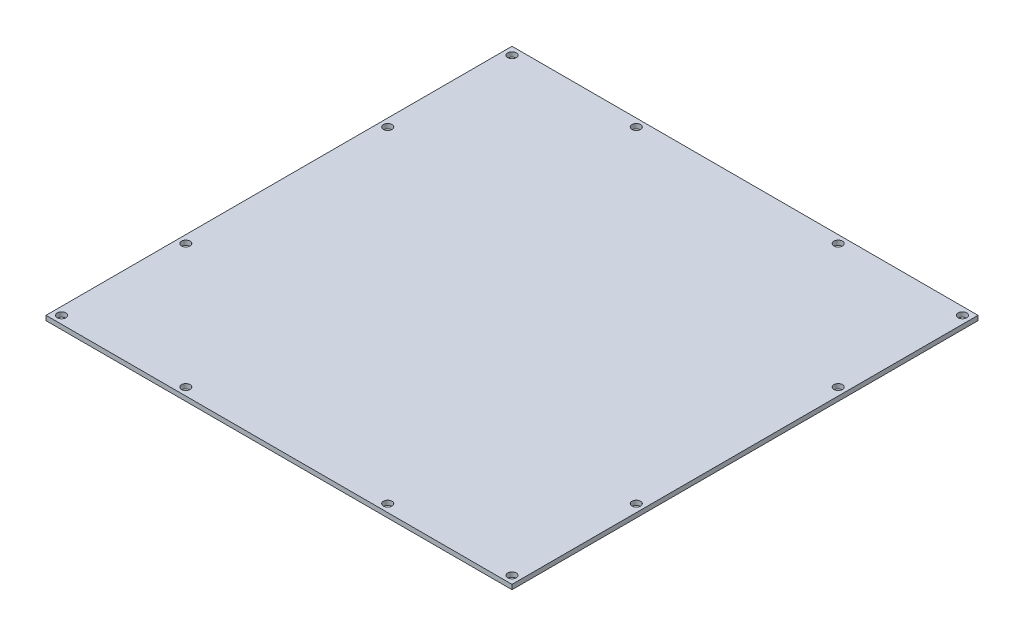
from build123d import *

# Parameters (mm, degrees)
SKETCH1_W                = 300
SKETCH1_H                = 300
BOSS_EXTRUDE1_DEPTH      = 3
M5_CLEARANCE_HOLE1_D     = 5.5
M5_CLEARANCE_HOLE1_DEPTH = 10
M5_CLEARANCE_HOLE1_TIP   = 1.652366702


with BuildPart() as part:
    # Sketch1 → Boss-Extrude1 (new body)
    with BuildSketch(Plane(origin=(0, 0, 0), x_dir=(1, 0, 0), z_dir=(0, 1, 0))):
        Rectangle(SKETCH1_W, SKETCH1_H)
    extrude(amount=BOSS_EXTRUDE1_DEPTH)

    # M5 Clearance Hole1
    with Locations(Plane(origin=(0, 3, 0), x_dir=(1, 0, 0), z_dir=(0, 1, 0))):
        with Locations((-145, 145), (145, -145), (-145, -145), (145, 145), (-65, 145), (65, 145), (65, -145), (-65, -145), (-145, 65), (-145, -65), (145, 65), (145, -65)):
            Hole(M5_CLEARANCE_HOLE1_D / 2, depth=M5_CLEARANCE_HOLE1_DEPTH)
            with Locations((0, 0, -(M5_CLEARANCE_HOLE1_DEPTH + M5_CLEARANCE_HOLE1_TIP / 2))):  # 118° drill point
                Cone(0, M5_CLEARANCE_HOLE1_D / 2, M5_CLEARANCE_HOLE1_TIP, mode=Mode.SUBTRACT)


solid = part.part
